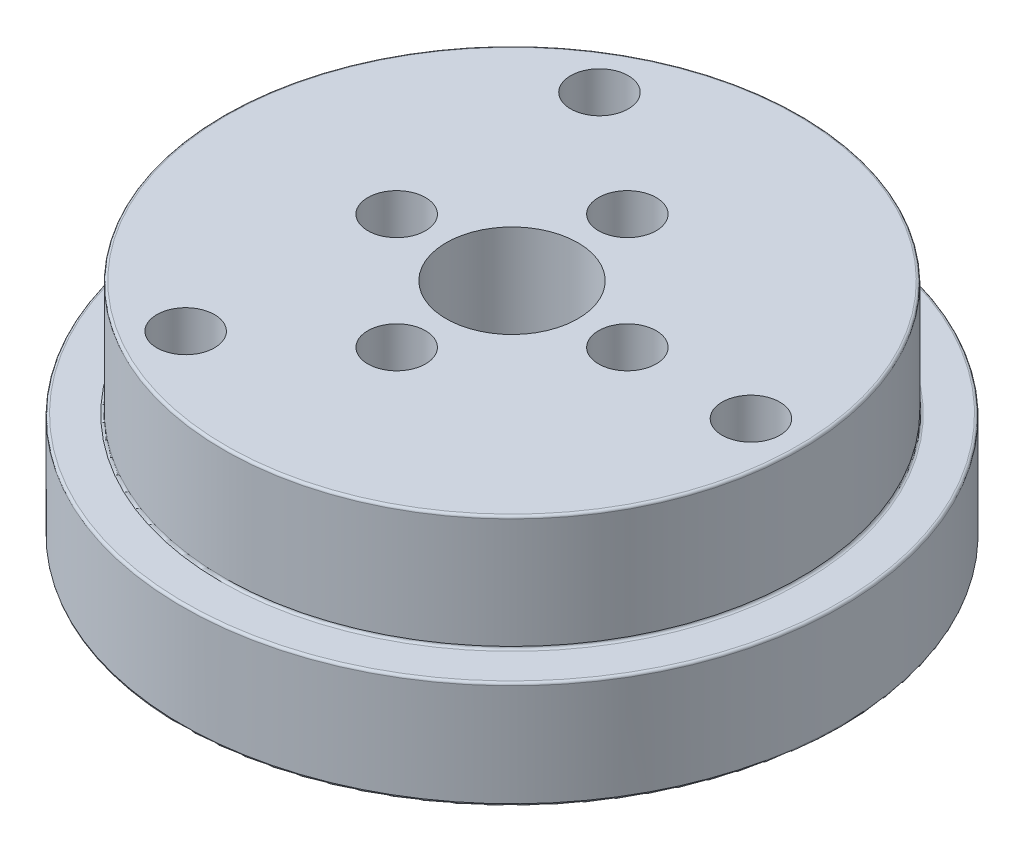
from build123d import *

# Parameters (mm, degrees)
SKETCH2_R          = 1.75
SKETCH2_R_2        = 4
CUT_EXTRUDE4_DEPTH = 32.340867888
SKETCH7_R          = 11
CUT_EXTRUDE5_DEPTH = 7.5
FILLET1_R          = 0.15


with BuildPart() as part:
    # Sketch1 → Revolve1 (revolve)
    with BuildSketch(Plane.XY):
        Polygon((0, 0), (-20, 0), (-20, 6.5), (-17.5, 6.5), (-17.5, 13.5), (0, 13.5), align=None)
    revolve(axis=Axis((0, 13.5, 0), (0, -1, 0)))

    # Sketch2 → Cut-Extrude4 (cut, through all)
    with BuildSketch(Plane.XZ):
        with Locations(Location((-7.25, 12.557368355, 0), (0, 0, 270))):
            Circle(SKETCH2_R)
        with Locations(Location((-7.25, -12.557368355, 0), (0, 0, 270))):
            Circle(SKETCH2_R)
        with Locations(Location((14.5, 0, 0), (0, 0, 270))):
            Circle(SKETCH2_R)
        with Locations(Location((7, 0, 0), (0, 0, 270))):
            Circle(SKETCH2_R)
        with Locations(Location((0, -7, 0), (0, 0, 270))):
            Circle(SKETCH2_R)
        with Locations(Location((-7, 0, 0), (0, 0, 270))):
            Circle(SKETCH2_R)
        with Locations(Location((0, 7, 0), (0, 0, 270))):
            Circle(SKETCH2_R)
        with Locations(Location((0, 0, 0), (0, 0, 270))):
            Circle(SKETCH2_R_2)
    extrude(amount=-CUT_EXTRUDE4_DEPTH, mode=Mode.SUBTRACT)

    # Sketch7 → Cut-Extrude5 (cut)
    with BuildSketch(Plane.XZ):
        with Locations(Location((0, 0, 0), (0, 0, 270))):
            Circle(SKETCH7_R)
    extrude(amount=-CUT_EXTRUDE5_DEPTH, mode=Mode.SUBTRACT)

    # Fillet1
    fillet1_edges = [part.edges().sort_by_distance(p)[0] for p in [
        (17.5, 13.5, 0),
        (17.5, 6.5, 0),
        (20, 6.5, 0),
        (20, 0, 0),
    ]]
    fillet(fillet1_edges, radius=FILLET1_R)


solid = part.part
